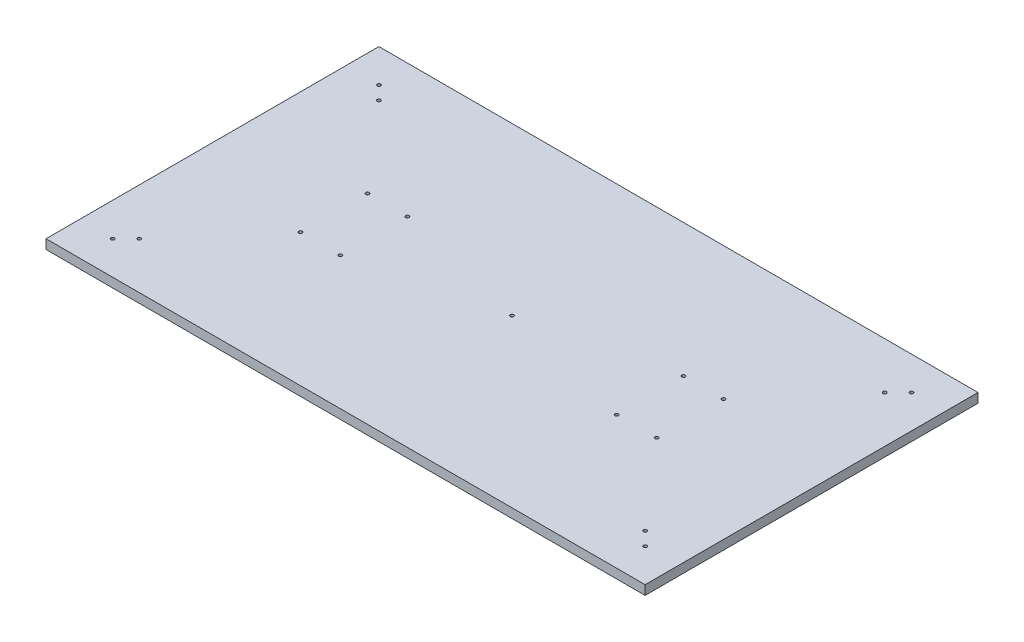
from build123d import *

# Parameters (mm, degrees)
SKETCH1_W           = 900
SKETCH1_H           = 500
BOSS_EXTRUDE1_DEPTH = 14
SKETCH2_R           = 2.6
CUT_EXTRUDE1_DEPTH  = 10


with BuildPart() as part:
    # Sketch1 → Boss-Extrude1 (new body)
    with BuildSketch(Plane(origin=(0, 0, 0), x_dir=(1, 0, 0), z_dir=(0, 1, 0))):
        Rectangle(SKETCH1_W, SKETCH1_H)
    extrude(amount=BOSS_EXTRUDE1_DEPTH)

    # Sketch2 → Cut-Extrude1 (cut)
    with BuildSketch(Plane(origin=(0, 14, 0), x_dir=(1, 0, 0), z_dir=(0, 1, 0))):
        with Locations(Location((-207.5, 50.3, 0), (0, 0, 270))):
            Circle(SKETCH2_R)
        with Locations(Location((-207.5, -50.3, 0), (0, 0, 270))):
            Circle(SKETCH2_R)
        with Locations(Location((0, 0, 0), (0, 0, 270))):
            Circle(SKETCH2_R)
        with Locations(Location((-267.5, -50.3, 0), (0, 0, 270))):
            Circle(SKETCH2_R)
        with Locations(Location((-267.5, 50.3, 0), (0, 0, 90))):
            Circle(SKETCH2_R)
        with Locations(Location((-400, -200, 0), (0, 0, 270))):
            Circle(SKETCH2_R)
        with Locations(Location((-380, -180, 0), (0, 0, 270))):
            Circle(SKETCH2_R)
        with Locations(Location((-380, 180, 0), (0, 0, 90))):
            Circle(SKETCH2_R)
        with Locations(Location((-400, 200, 0), (0, 0, 90))):
            Circle(SKETCH2_R)
        with Locations(Location((400, -200, 0), (0, 0, 90))):
            Circle(SKETCH2_R)
        with Locations(Location((380, -180, 0), (0, 0, 90))):
            Circle(SKETCH2_R)
        with Locations(Location((400, 200, 0), (0, 0, 270))):
            Circle(SKETCH2_R)
        with Locations(Location((380, 180, 0), (0, 0, 270))):
            Circle(SKETCH2_R)
        with Locations(Location((267.5, 50.3, 0), (0, 0, 270))):
            Circle(SKETCH2_R)
        with Locations(Location((267.5, -50.3, 0), (0, 0, 90))):
            Circle(SKETCH2_R)
        with Locations(Location((207.5, -50.3, 0), (0, 0, 90))):
            Circle(SKETCH2_R)
        with Locations(Location((207.5, 50.3, 0), (0, 0, 90))):
            Circle(SKETCH2_R)
    extrude(amount=-CUT_EXTRUDE1_DEPTH, mode=Mode.SUBTRACT)


solid = part.part
